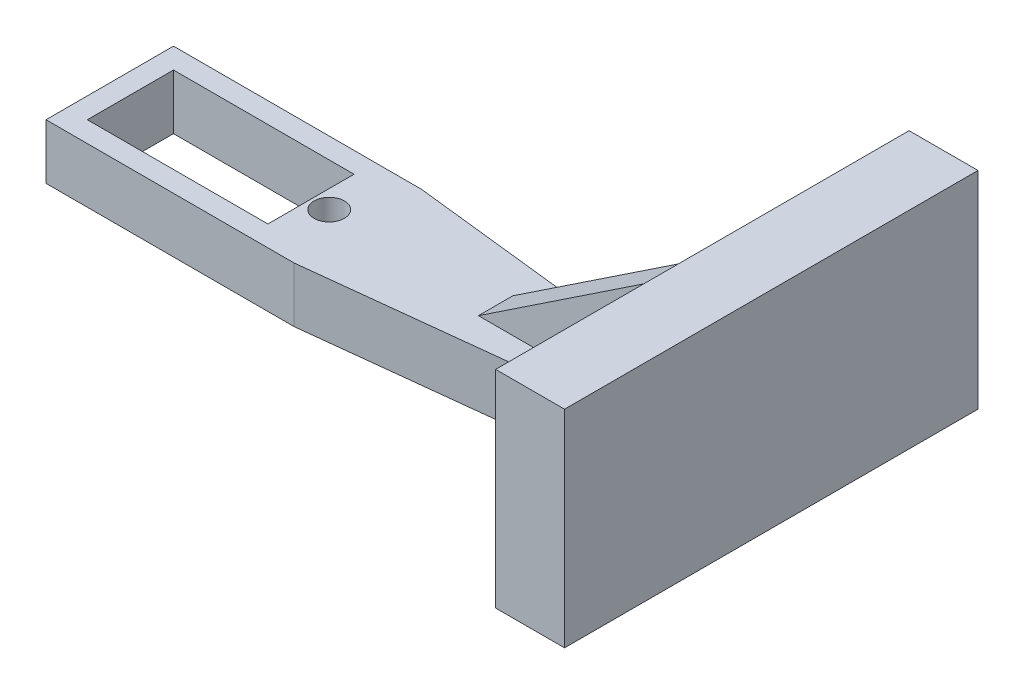
from build123d import *

# Parameters (mm, degrees)
SKETCH_1_W                   = 36
SKETCH_1_H                   = 18.5
EXTRUDE_1_DEPTH              = 8
HOLE_WIZARD_M2_1_D           = 2.4
HOLE_WIZARD_M2_1_CBORE_D     = 4.4
HOLE_WIZARD_M2_1_CBORE_DEPTH = 3.5
SKETCH_8_W                   = 60
SKETCH_8_H                   = 30
EXTRUDE_2_DEPTH              = 10
EXTRUDE_3_DEPTH              = 2.5


with BuildPart() as part:
    # 草图1 → 凸台-拉伸1 (new body)
    with BuildSketch(Plane(origin=(0, 0, 0), x_dir=(1, 0, 0), z_dir=(0, 1, 0))):
        with Locations((-18, 0)):
            Rectangle(SKETCH_1_W, SKETCH_1_H)
        Polygon((-6.8, 6.25), (-29.2, 6.25), (-33, 6.25), (-33, -6.25), (-29.2, -6.25), (-6.8, -6.25), align=None, mode=Mode.SUBTRACT)
    extrude(amount=EXTRUDE_1_DEPTH)

    # M2 凹头盖螺钉的柱形沉头孔1 (through all)
    with Locations(Plane(origin=(-4.15, 8, 0), x_dir=(0, 0, 1), z_dir=(0, 1, 0))):
        with Locations((0, 0)):
            CounterBoreHole(HOLE_WIZARD_M2_1_D / 2, HOLE_WIZARD_M2_1_CBORE_D / 2, HOLE_WIZARD_M2_1_CBORE_DEPTH)

    # 草图4 → 放样1 section 0
    with BuildSketch(Plane(origin=(0, 0, 0), x_dir=(0, 0, -1), z_dir=(1, 0, 0))):
        with BuildLine():
            Line((9.25, 8), (-9.25, 8))
            Line((-9.25, 8), (-9.25, 0))
            Line((-9.25, 0), (9.25, 0))
            Line((9.25, 0), (9.25, 8))
        make_face()
    # 草图5 → 放样1 section 1
    with BuildSketch(Plane(origin=(60, 0, 0), x_dir=(0, 0, -1), z_dir=(1, 0, 0))):
        with BuildLine():
            Line((-2.5, 8), (2.5, 8))
            Line((2.5, 8), (2.5, 0))
            Line((2.5, 0), (-2.5, 0))
            Line((-2.5, 0), (-2.5, 8))
        make_face()
    loft()

    # 草图8 → 凸台-拉伸2 (add)
    with BuildSketch(Plane(origin=(60, 0, 0), x_dir=(0, 0, -1), z_dir=(1, 0, 0))):
        with Locations((0, 15)):
            Rectangle(SKETCH_8_W, SKETCH_8_H)
    extrude(amount=-EXTRUDE_2_DEPTH)

    # 草图11 → 凸台-拉伸3 (add, symmetric)
    with BuildSketch(Plane.XY):
        Polygon((50, 28), (20, 8), (50, 8), align=None)
    extrude(amount=EXTRUDE_3_DEPTH, both=True)


solid = part.part
